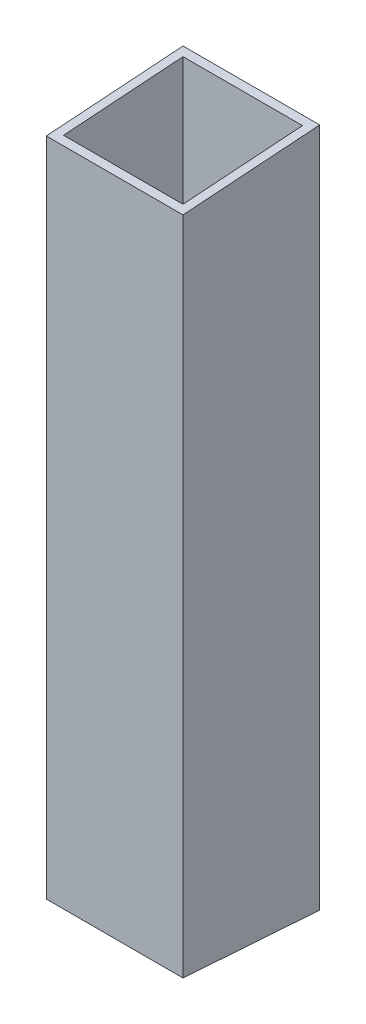
from build123d import *

# Parameters (mm, degrees)
SKETCH1_W               = 19.05
SKETCH1_H               = 19.05
BOSS_EXTRUDE1_DEPTH     = 92.1
BOSS_EXTRUDE2_DEPTH     = 19.05
CUT_EXTRUDE1_DEPTH      = 95.398144252
CUT_EXTRUDE1_DEPTH_BACK = 95.398144252
SKETCH4_W               = 16.65
SKETCH4_H               = 16.65


with BuildPart() as part:
    # Sketch1 → Boss-Extrude1 (new body)
    with BuildSketch(Plane(origin=(0, 0, 0), x_dir=(1, 0, 0), z_dir=(0, 1, 0))):
        Rectangle(SKETCH1_W, SKETCH1_H)
    extrude(amount=BOSS_EXTRUDE1_DEPTH)

    # Sketch2 → Boss-Extrude2 (add)
    with BuildSketch(Plane(origin=(9.525, 0, 0), x_dir=(0, 0, -1), z_dir=(1, 0, 0))):
        Polygon((-9.525, 92.1), (9.525, 92.1), (9.525, 93.432105768), align=None)
        Polygon((9.525, -1.332105768), (-9.525, 0), (9.525, 0), align=None)
    extrude(amount=-BOSS_EXTRUDE2_DEPTH)

    # Sketch4 → Cut-Extrude1 (cut, two sides: drawn at the far end of the back side and taken through both)
    with BuildSketch(Plane(origin=(0, 0, 0), x_dir=(1, 0, 0), z_dir=(0, 1, 0)).offset(-CUT_EXTRUDE1_DEPTH_BACK)):
        Rectangle(SKETCH4_W, SKETCH4_H)
    extrude(amount=CUT_EXTRUDE1_DEPTH + CUT_EXTRUDE1_DEPTH_BACK, mode=Mode.SUBTRACT)


solid = part.part
